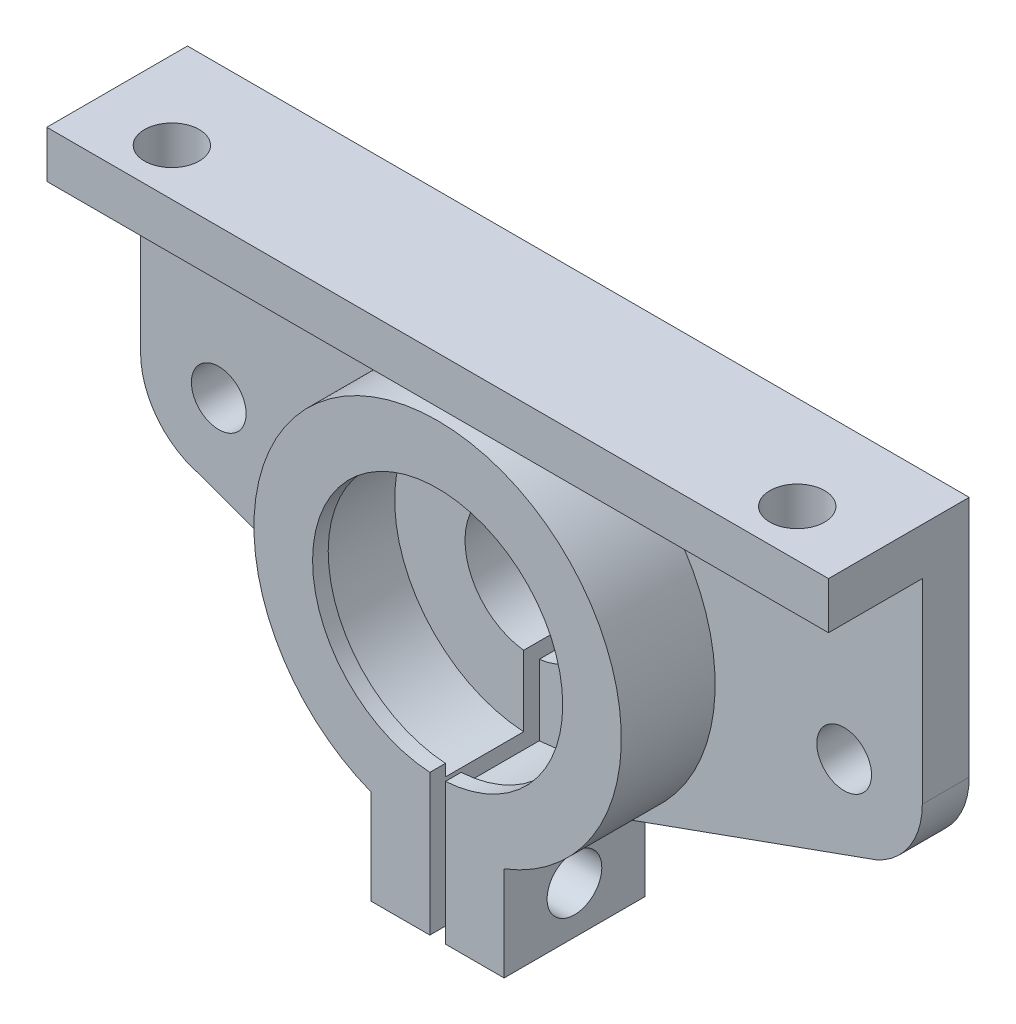
from build123d import *

# Parameters (mm, degrees)
SKETCH1_R                = 3.5
SKETCH1_R_2              = 8.5
BOSS_EXTRUDE1_DEPTH      = 6
SKETCH2_R                = 17.5
BOSS_EXTRUDE2_DEPTH      = 12
SKETCH4_W                = 1.5
SKETCH4_H                = 2
CUT_EXTRUDE1_DEPTH       = 64.087241182
CUT_EXTRUDE1_DEPTH_BACK  = 64.087241182
SKETCH5_R                = 3.5
BOSS_EXTRUDE6_DEPTH      = 50
BOSS_EXTRUDE6_DEPTH_BACK = 50
SKETCH9_W                = 18
SKETCH9_H                = 6
CUT_EXTRUDE10_DEPTH      = 64.087241182
CUT_EXTRUDE10_DEPTH_BACK = 64.087241182
SKETCH10_W               = 2
SKETCH10_H               = 34
SKETCH11_R               = 3.5
CUT_EXTRUDE11_DEPTH      = 80.404030124


with BuildPart() as part:
    # Sketch1 → Boss-Extrude1 (new body)
    with BuildSketch(Plane.XY):
        with BuildLine():
            Line((-42.544589072, -9.670835871), (-8.5, -21.9089023))
            Line((-8.5, -21.9089023), (-8.5, -34))
            Line((-8.5, -34), (8.5, -34))
            Line((8.5, -34), (8.5, -21.9089023))
            Line((8.5, -21.9089023), (42.544589072, -9.670835871))
            Line((42.544589072, -9.670835871), (44.194936835, -9.07758255))
            ThreePointArc((44.194936835, -9.07758255), (48.424647422, -5.38751481), (50, 0))
            Line((50, 0), (50, 25))
            Line((50, 25), (-50, 25))
            Line((-50, 25), (-50, 0))
            ThreePointArc((-50, 0), (-48.424647422, -5.38751481), (-44.194936835, -9.07758255))
            Line((-44.194936835, -9.07758255), (-42.544589072, -9.670835871))
        make_face()
        with Locations((-40, 0)):
            Circle(SKETCH1_R, mode=Mode.SUBTRACT)
        Circle(SKETCH1_R_2, mode=Mode.SUBTRACT)
        with Locations((40, 0)):
            Circle(SKETCH1_R, mode=Mode.SUBTRACT)
    extrude(amount=BOSS_EXTRUDE1_DEPTH)

    # Sketch2 → Boss-Extrude2 (add)
    with BuildSketch(Plane.XY.offset(6)):
        with BuildLine():
            Line((-8.5, -34), (8.5, -34))
            Line((8.5, -34), (8.5, -21.9089023))
            ThreePointArc((8.5, -21.9089023), (0, 23.5), (-8.5, -21.9089023))
            Line((-8.5, -21.9089023), (-8.5, -34))
        make_face()
        Circle(SKETCH2_R, mode=Mode.SUBTRACT)
    extrude(amount=BOSS_EXTRUDE2_DEPTH)

    # Sweep1: sweep along a curve in space
    with BuildLine() as sweep1_path:
        ThreePointArc((17.5, 0, 18), (12.374368671, 12.374368671, 18), (0, 17.5, 18))
        ThreePointArc((0, 17.5, 18), (-12.374368671, 12.374368671, 18), (-17.5, 0, 18))
        ThreePointArc((-17.5, 0, 18), (-12.374368671, -12.374368671, 18), (0, -17.5, 18))
        ThreePointArc((0, -17.5, 18), (12.374368671, -12.374368671, 18), (17.5, 0, 18))
    # Sketch4 → Sweep1 (sweep)
    with BuildSketch(Plane(origin=(0, 0, 0), x_dir=(1, 0, 0), z_dir=(0, 1, 0))):
        with Locations((16.75, -17)):
            Rectangle(SKETCH4_W, SKETCH4_H)
    sweep(path=sweep1_path.line)

    # Sketch5 → Cut-Extrude1 (cut, two sides: drawn at the far end of the back side and taken through both)
    with BuildSketch(Plane(origin=(0, 0, 0), x_dir=(0, 0, -1), z_dir=(1, 0, 0)).offset(-CUT_EXTRUDE1_DEPTH_BACK)):
        with Locations(Location((-9, -28, 0), (0, 0, 180))):
            Circle(SKETCH5_R)
    extrude(amount=CUT_EXTRUDE1_DEPTH + CUT_EXTRUDE1_DEPTH_BACK, mode=Mode.SUBTRACT)

    # Sketch9 → Boss-Extrude6 (add, two sides: drawn at the far end of the back side and taken through both)
    with BuildSketch(Plane(origin=(0, 0, 0), x_dir=(0, 0, -1), z_dir=(1, 0, 0)).offset(-BOSS_EXTRUDE6_DEPTH_BACK)):
        with Locations((-9, 28)):
            Rectangle(SKETCH9_W, SKETCH9_H)
    extrude(amount=BOSS_EXTRUDE6_DEPTH + BOSS_EXTRUDE6_DEPTH_BACK)

    # Sketch10 → Cut-Extrude10 (cut, two sides: drawn at the far end of the back side and taken through both)
    with BuildSketch(Plane.XY.offset(-CUT_EXTRUDE10_DEPTH_BACK)):
        with Locations((0, -17)):
            Rectangle(SKETCH10_W, SKETCH10_H)
    extrude(amount=CUT_EXTRUDE10_DEPTH + CUT_EXTRUDE10_DEPTH_BACK, mode=Mode.SUBTRACT)

    # Sketch11 → Cut-Extrude11 (cut, through all)
    with BuildSketch(Plane.XZ.offset(-25)):
        with Locations(Location((-40, 12, 0), (0, 0, 270))):
            Circle(SKETCH11_R)
        with Locations(Location((40, 12, 0), (0, 0, 270))):
            Circle(SKETCH11_R)
    extrude(amount=-CUT_EXTRUDE11_DEPTH, mode=Mode.SUBTRACT)


solid = part.part
